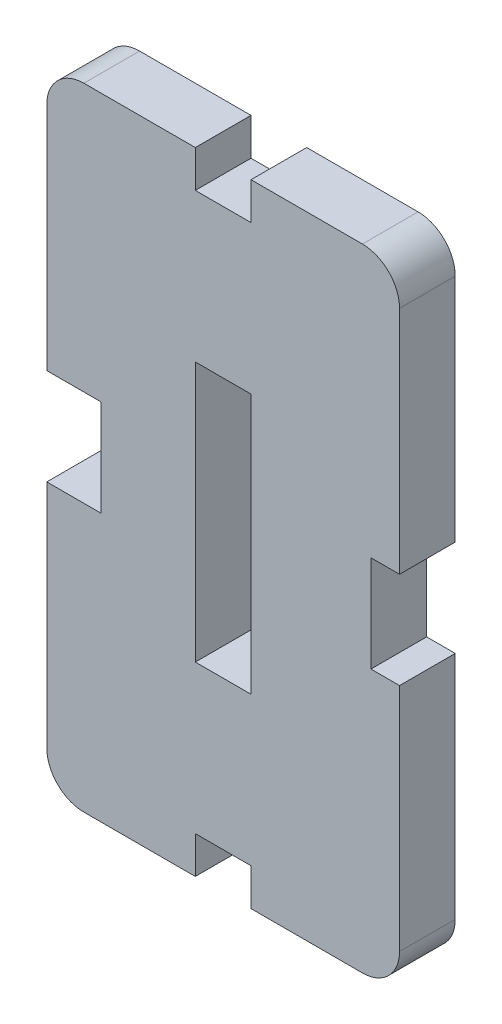
from build123d import *

# Parameters (mm, degrees)
SKETCH1_W          = 3
SKETCH1_H          = 14
BASE_EXTRUDE_DEPTH = 3


with BuildPart() as part:
    # Sketch1 → Base-Extrude (new body)
    with BuildSketch(Plane.XY):
        with BuildLine():
            Line((-1033.116910611, 53.997744838), (-1033.116910611, 41.593073912))
            Line((-1033.116910611, 41.593073912), (-1034.65769353, 41.593073912))
            Line((-1034.65769353, 41.593073912), (-1034.65769353, 36.402415763))
            Line((-1034.65769353, 36.402415763), (-1033.116910611, 36.402415763))
            Line((-1033.116910611, 36.402415763), (-1033.116910611, 23.997744838))
            ThreePointArc((-1033.116910611, 23.997744838), (-1033.702697049, 22.583531275), (-1035.116910611, 21.997744838))
            Line((-1035.116910611, 21.997744838), (-1041.116910611, 21.997744838))
            Line((-1041.116910611, 21.997744838), (-1041.116910611, 23.997744838))
            Line((-1041.116910611, 23.997744838), (-1042.616910611, 23.997744838))
            Line((-1042.616910611, 23.997744838), (-1044.116910611, 23.997744838))
            Line((-1044.116910611, 23.997744838), (-1044.116910611, 21.997744838))
            Line((-1044.116910611, 21.997744838), (-1050.116910611, 21.997744838))
            ThreePointArc((-1050.116910611, 21.997744838), (-1051.531124173, 22.583531275), (-1052.116910611, 23.997744838))
            Line((-1052.116910611, 23.997744838), (-1052.116910611, 36.402415763))
            Line((-1052.116910611, 36.402415763), (-1049.190418334, 36.402415763))
            Line((-1049.190418334, 36.402415763), (-1049.190418334, 41.593073912))
            Line((-1049.190418334, 41.593073912), (-1052.116910611, 41.593073912))
            Line((-1052.116910611, 41.593073912), (-1052.116910611, 53.997744838))
            ThreePointArc((-1052.116910611, 53.997744838), (-1051.531124173, 55.4119584), (-1050.116910611, 55.997744838))
            Line((-1050.116910611, 55.997744838), (-1044.116910611, 55.997744838))
            Line((-1044.116910611, 55.997744838), (-1044.116910611, 53.997744838))
            Line((-1044.116910611, 53.997744838), (-1042.616910611, 53.997744838))
            Line((-1042.616910611, 53.997744838), (-1041.116910611, 53.997744838))
            Line((-1041.116910611, 53.997744838), (-1041.116910611, 55.997744838))
            Line((-1041.116910611, 55.997744838), (-1035.116910611, 55.997744838))
            ThreePointArc((-1035.116910611, 55.997744838), (-1033.702697049, 55.4119584), (-1033.116910611, 53.997744838))
        make_face()
        with Locations((-1042.616910611, 38.997744838)):
            Rectangle(SKETCH1_W, SKETCH1_H, mode=Mode.SUBTRACT)
    extrude(amount=BASE_EXTRUDE_DEPTH)


solid = part.part
